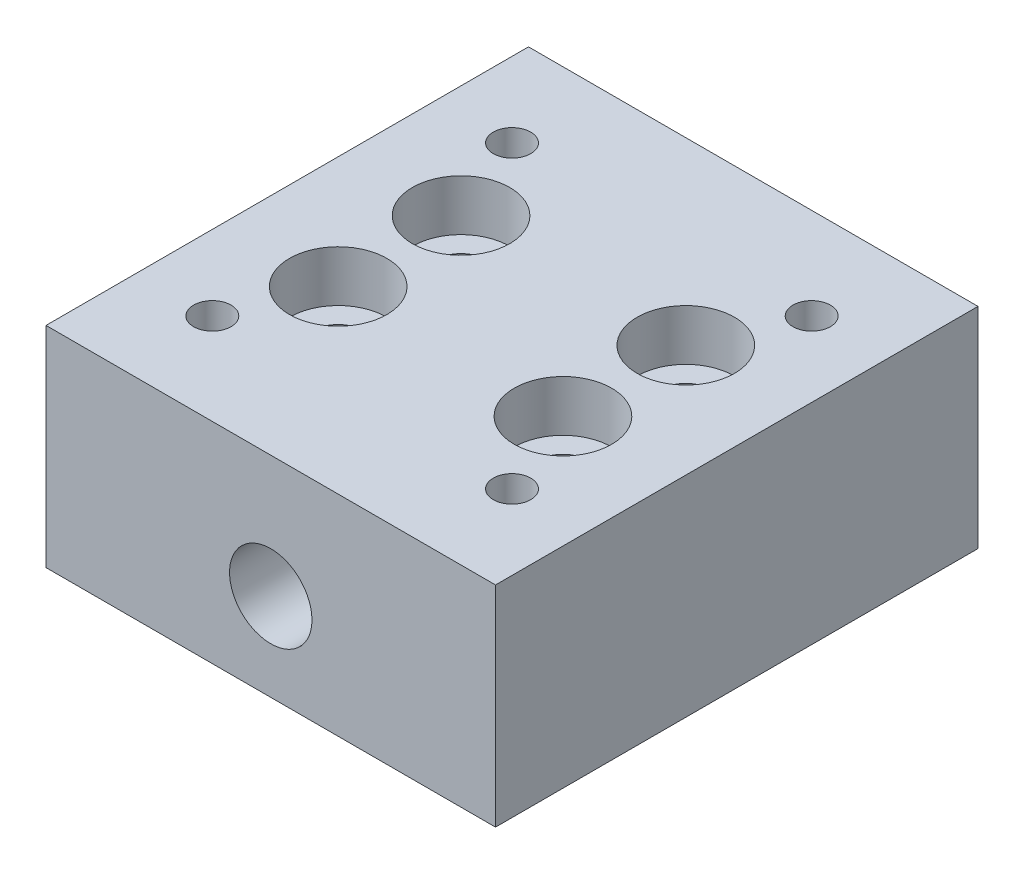
from build123d import *

# Parameters (mm, degrees)
SKETCH_1_W             = 30
SKETCH_1_H             = 32.2
BODY_DEPTH             = 14
FIXTURE_M3_D           = 3.4
FIXTURE_M3_DEPTH       = 14
FIXTURE_M3_CBORE_D     = 6.5
FIXTURE_M3_CBORE_DEPTH = 3.4
FIXTURE_M3_TIP         = 1.021463052
FIXTURE_M3_1_D         = 2.5
FIXTURE_M3_1_DEPTH     = 8.5
FIXTURE_M3_1_TIP       = 0.751075774
SKETCH_6_R             = 2.75
HOLE_DEPTH             = 32.2
OVAL_DEPTH             = 6
SKETCH_8_R             = 5
HOLE2_DEPTH            = 22


with BuildPart() as part:
    # Эскиз1 → Body (new body)
    with BuildSketch(Plane(origin=(0, 11.5, 0), x_dir=(1, 0, 0), z_dir=(0, 1, 0))):
        with Locations((0, -42.150641757)):
            Rectangle(SKETCH_1_W, SKETCH_1_H)
    extrude(amount=BODY_DEPTH)

    # Fixture M3
    with Locations(Plane(origin=(-7.5, 25.5, 38.050641757), x_dir=(0, 0, 1), z_dir=(0, 1, 0))):
        with Locations((0, 0), (8.2, 0), (0, 15), (8.2, 15)):
            CounterBoreHole(FIXTURE_M3_D / 2, FIXTURE_M3_CBORE_D / 2, FIXTURE_M3_CBORE_DEPTH, depth=FIXTURE_M3_DEPTH)
            with Locations((0, 0, -(FIXTURE_M3_DEPTH + FIXTURE_M3_TIP / 2))):  # 118° drill point
                Cone(0, FIXTURE_M3_D / 2, FIXTURE_M3_TIP, mode=Mode.SUBTRACT)

    # Fixture M3_1
    with Locations(Plane(origin=(-10, 25.5, 32.150641757), x_dir=(0, 0, 1), z_dir=(0, 1, 0))):
        with Locations((0, 0), (0, 20), (20, 20), (20, 0)):
            Hole(FIXTURE_M3_1_D / 2, depth=FIXTURE_M3_1_DEPTH)
            with Locations((0, 0, -(FIXTURE_M3_1_DEPTH + FIXTURE_M3_1_TIP / 2))):  # 118° drill point
                Cone(0, FIXTURE_M3_1_D / 2, FIXTURE_M3_1_TIP, mode=Mode.SUBTRACT)

    # Эскиз6 → Hole (cut)
    with BuildSketch(Plane.XY.offset(58.250641757)):
        with Locations((0, 17.35)):
            Circle(SKETCH_6_R)
    extrude(amount=-HOLE_DEPTH, mode=Mode.SUBTRACT)

    # Эскиз7 → Oval (cut)
    with BuildSketch(Plane(origin=(0, 0, 26.050641757), x_dir=(-1, 0, 0), z_dir=(0, 0, -1))):
        with BuildLine():
            Line((-2.5, 22.35), (2.5, 22.35))
            ThreePointArc((2.5, 22.35), (7.5, 17.35), (2.5, 12.35))
            Line((2.5, 12.35), (-2.5, 12.35))
            ThreePointArc((-2.5, 12.35), (-7.5, 17.35), (-2.5, 22.35))
        make_face()
    extrude(amount=-OVAL_DEPTH, mode=Mode.SUBTRACT)

    # Эскиз8 → Hole2 (cut)
    with BuildSketch(Plane(origin=(0, 0, 26.050641757), x_dir=(-1, 0, 0), z_dir=(0, 0, -1))):
        with Locations(Location((0, 17.35, 0), (0, 0, 90))):
            Circle(SKETCH_8_R)
    extrude(amount=-HOLE2_DEPTH, mode=Mode.SUBTRACT)


solid = part.part
